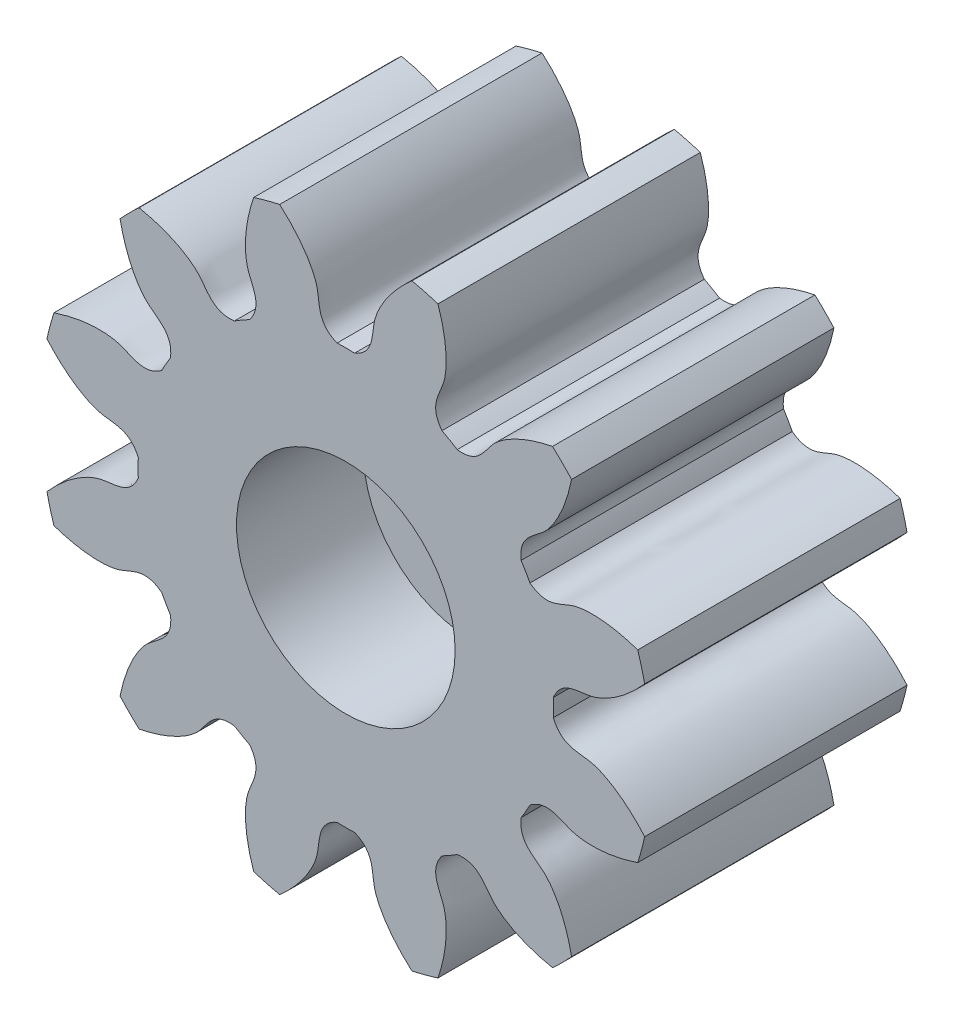
from build123d import *

# Parameters (mm, degrees)
SKETCH_1_R               = 7
EXTRUDE_1_DEPTH          = 6
CUT_EXTRUDE_1_DEPTH      = 12.575836903
PATTERN_CIRCULAR_1_COUNT = 12
SKETCH_4_R               = 2.5
CUT_EXTRUDE_3_DEPTH      = 2.9
SKETCH_5_R               = 0.9
CUT_EXTRUDE_5_DEPTH      = 3.5


with BuildPart() as part:
    # 草图1 → 凸台-拉伸1 (new body)
    with BuildSketch(Plane.XY):
        Circle(SKETCH_1_R)
    extrude(amount=EXTRUDE_1_DEPTH)

    # 草图2 → 切除-拉伸1 (cut, through all)
    with BuildSketch(Plane.XY):
        with BuildLine():
            ThreePointArc((0.200840113, 4.745752127), (0, 4.75), (-0.200840113, 4.745752127))
            add(Edge.make_bspline(
                [(-0.200840113, 4.745752127), (-0.680788869, 4.949307463), (-0.574373479, 5.344818682), (-0.676152188, 5.689480578), (-0.682623854, 5.709905737), (-0.690227251, 5.732333425), (-0.699042869, 5.756726088), (-0.709152625, 5.783043239), (-0.720636516, 5.811242069), (-0.733573561, 5.841277296), (-0.748041431, 5.873101252), (-0.764116477, 5.906663899), (-0.781873638, 5.941912871), (-0.801386385, 5.978793506), (-0.822726663, 6.017248887), (-0.845964824, 6.057219881), (-0.871169571, 6.098645179), (-0.898407898, 6.141461339), (-0.927745034, 6.185602833), (-0.959244384, 6.231002089), (-0.992967476, 6.277589538), (-1.028973904, 6.325293664), (-1.067321278, 6.374041055), (-1.10806517, 6.423756452), (-1.151259065, 6.474362799), (-1.19695431, 6.525781303), (-1.245200067, 6.577931484), (-1.296043265, 6.630731232), (-1.349528558, 6.684096867), (-1.405698277, 6.737943194), (-1.464592392, 6.792183563), (-1.526248467, 6.846729933), (-1.590701621, 6.901492931), (-1.657984495, 6.956381914), (-1.728127208, 7.011305035), (-1.801157328, 7.066169307), (-1.877099836, 7.120880668), (-1.955977095, 7.175344048), (-2.03780882, 7.229463435), (-2.12261205, 7.283141947), (-2.210401121, 7.336281894), (-2.301187639, 7.388784855), (-2.394980461, 7.440551744), (-2.491785669, 7.49148288), (-2.591606554, 7.541478062), (-2.694443593, 7.59043664), (-2.800294437, 7.638257584), (-2.909153896, 7.684839562), (-3.021013926, 7.730081009), (-3.135863605, 7.773880207), (-3.294379706, 7.830727959), (-3.4155936, 7.870101408), (-3.497605402, 7.89497091)],
                knots=[0, 0, 0, 0, 0.218015236, 0.222043642, 0.226545979, 0.231522246, 0.236972443, 0.24289657, 0.249294627, 0.256166614, 0.263512532, 0.271332379, 0.279626157, 0.288393865, 0.297635503, 0.307351072, 0.31754057, 0.328203999, 0.339341357, 0.350952646, 0.363037866, 0.375597015, 0.388630094, 0.402137104, 0.416118043, 0.430572913, 0.445501713, 0.460904444, 0.476781104, 0.493131694, 0.509956215, 0.527254666, 0.545027047, 0.563273358, 0.581993599, 0.601187771, 0.620855872, 0.640997904, 0.661613866, 0.682703758, 0.704267581, 0.726305333, 0.748817015, 0.771802628, 0.795262171, 0.819195644, 0.843603047, 0.868484381, 0.893839644, 0.919668838, 0.945971962, 1, 1, 1, 1], degree=3))
            ThreePointArc((-3.497605402, 7.89497091), (0, 8.635033829), (3.497605402, 7.89497091))
            add(Edge.make_bspline(
                [(0.200840113, 4.745752127), (0.680788869, 4.949307463), (0.574373479, 5.344818682), (0.676152188, 5.689480578), (0.682623854, 5.709905737), (0.690227251, 5.732333425), (0.699042869, 5.756726088), (0.709152625, 5.783043239), (0.720636516, 5.811242069), (0.733573561, 5.841277296), (0.748041431, 5.873101252), (0.764116477, 5.906663899), (0.781873638, 5.941912871), (0.801386385, 5.978793506), (0.822726663, 6.017248887), (0.845964824, 6.057219881), (0.871169571, 6.098645179), (0.898407898, 6.141461339), (0.927745034, 6.185602833), (0.959244384, 6.231002089), (0.992967476, 6.277589538), (1.028973904, 6.325293664), (1.067321278, 6.374041055), (1.10806517, 6.423756452), (1.151259065, 6.474362799), (1.19695431, 6.525781303), (1.245200067, 6.577931484), (1.296043265, 6.630731232), (1.349528558, 6.684096867), (1.405698277, 6.737943194), (1.464592392, 6.792183563), (1.526248467, 6.846729933), (1.590701621, 6.901492931), (1.657984495, 6.956381914), (1.728127208, 7.011305035), (1.801157328, 7.066169307), (1.877099836, 7.120880668), (1.955977095, 7.175344048), (2.03780882, 7.229463435), (2.12261205, 7.283141947), (2.210401121, 7.336281894), (2.301187639, 7.388784855), (2.394980461, 7.440551744), (2.491785669, 7.49148288), (2.591606554, 7.541478062), (2.694443593, 7.59043664), (2.800294437, 7.638257584), (2.909153896, 7.684839562), (3.021013926, 7.730081009), (3.135863605, 7.773880207), (3.294379706, 7.830727959), (3.4155936, 7.870101408), (3.497605402, 7.89497091)],
                knots=[0, 0, 0, 0, 0.218015236, 0.222043642, 0.226545979, 0.231522246, 0.236972443, 0.24289657, 0.249294627, 0.256166614, 0.263512532, 0.271332379, 0.279626157, 0.288393865, 0.297635503, 0.307351072, 0.31754057, 0.328203999, 0.339341357, 0.350952646, 0.363037866, 0.375597015, 0.388630094, 0.402137104, 0.416118043, 0.430572913, 0.445501713, 0.460904444, 0.476781104, 0.493131694, 0.509956215, 0.527254666, 0.545027047, 0.563273358, 0.581993599, 0.601187771, 0.620855872, 0.640997904, 0.661613866, 0.682703758, 0.704267581, 0.726305333, 0.748817015, 0.771802628, 0.795262171, 0.819195644, 0.843603047, 0.868484381, 0.893839644, 0.919668838, 0.945971962, 1, 1, 1, 1], degree=3))
        make_face()
    cut_extrude_1 = extrude(amount=CUT_EXTRUDE_1_DEPTH, mode=Mode.SUBTRACT)

    # 阵列(圆周)1: 切除-拉伸1 ×12 about axis
    pattern_circular_1_axis = Axis((0, 0, -0.3), (0, 0, 1))
    for i in range(1, PATTERN_CIRCULAR_1_COUNT):
        add(cut_extrude_1.rotate(pattern_circular_1_axis, i * 360 / PATTERN_CIRCULAR_1_COUNT), mode=Mode.SUBTRACT)

    # 草图4 → 切除-拉伸3 (cut)
    with BuildSketch(Plane.XY.offset(6)):
        Circle(SKETCH_4_R)
    extrude(amount=-CUT_EXTRUDE_3_DEPTH, mode=Mode.SUBTRACT)

    # 草图5 → 切除-拉伸5 (cut)
    with BuildSketch(Plane.XY.offset(3.1)):
        Circle(SKETCH_5_R)
    extrude(amount=-CUT_EXTRUDE_5_DEPTH, mode=Mode.SUBTRACT)


solid = part.part
